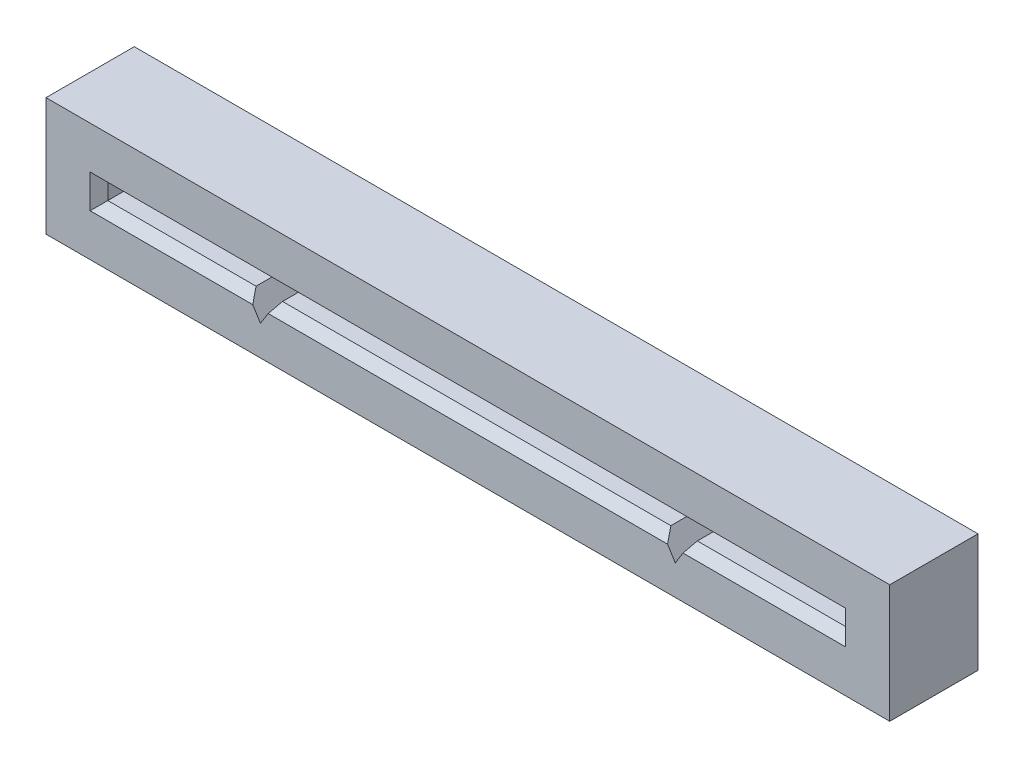
from build123d import *

# Parameters (mm, degrees)
SKETCH_1_W          = 47.8
SKETCH_1_H          = 6.7
EXTRUDE_1_DEPTH     = 5
CUT_EXTRUDE_1_DEPTH = 7.5
CHAMFER_1_SIZE      = 0.5


with BuildPart() as part:
    # Эскиз1 → Бобышка-Вытянуть1 (new body)
    with BuildSketch(Plane(origin=(0, 66.754264805, 0), x_dir=(-1, 0, 0), z_dir=(0, 0, 1))):
        with Locations((0, 66.754264805)):
            Rectangle(SKETCH_1_W, SKETCH_1_H)
    extrude(amount=EXTRUDE_1_DEPTH)

    # Эскиз6 → Вырез-Вытянуть1 (cut)
    with BuildSketch(Plane(origin=(0, 66.754264805, 5), x_dir=(-1, 0, 0), z_dir=(0, 0, 1))):
        Polygon((-20.9, 67.204264805), (-12.5, 67.204264805), (-11.75, 68.404264805), (-11, 67.204264805), (11, 67.204264805), (11.75, 68.404264805), (12.5, 67.204264805), (20.9, 67.204264805), (20.9, 66.304264805), (-20.9, 66.304264805), align=None)
    extrude(amount=-CUT_EXTRUDE_1_DEPTH, mode=Mode.SUBTRACT)

    # Фаска1
    chamfer_1_edges = [part.edges().sort_by_distance(p)[0] for p in [
        (16.7, -0.45, 5),
        (20.9, 0, 5),
        (0, 0.45, 5),
        (-20.9, 0, 5),
        (-16.7, -0.45, 5),
        (0, -0.45, 5),
    ]]
    chamfer(chamfer_1_edges, length=CHAMFER_1_SIZE)


solid = part.part
